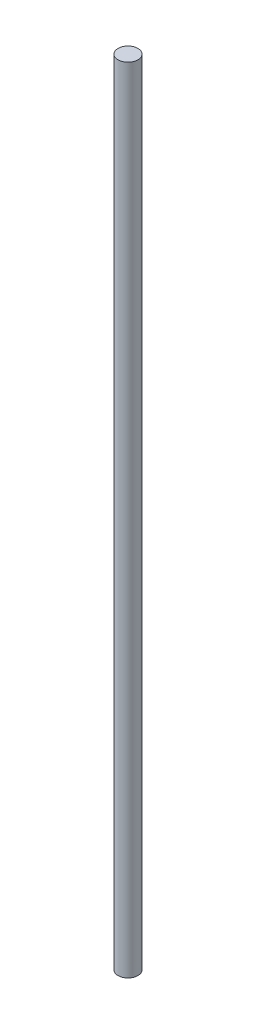
from build123d import *

# Parameters (mm, degrees)
SKETCH1_R           = 4.7625
BOSS_EXTRUDE1_DEPTH = 380


with BuildPart() as part:
    # Sketch1 → Boss-Extrude1 (new body)
    with BuildSketch(Plane(origin=(0, 0, 0), x_dir=(1, 0, 0), z_dir=(0, 1, 0))):
        with Locations(Location((0, 0, 0), (0, 0, 270))):
            Circle(SKETCH1_R)
    extrude(amount=BOSS_EXTRUDE1_DEPTH)


solid = part.part
